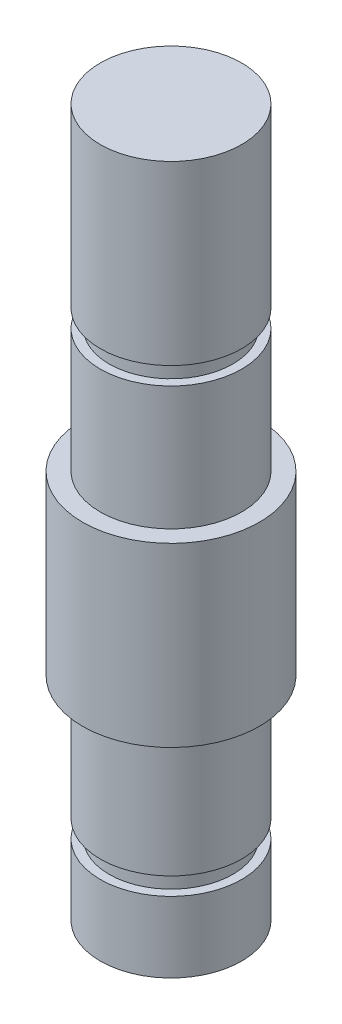
from build123d import *

# Parameters (mm, degrees)
SKETCH1_R           = 5
BOSS_EXTRUDE1_DEPTH = 17
SKETCH2_R           = 5
SKETCH2_R_2         = 4
CUT_EXTRUDE1_DEPTH  = 12
CUT_EXTRUDE2_START  = -4
SKETCH3_R           = 4
SKETCH3_R_2         = 3.5
CUT_EXTRUDE2_DEPTH  = 1
SKETCH4_R           = 4
BOSS_EXTRUDE2_DEPTH = 6


with BuildPart() as part:
    # Sketch1 → Boss-Extrude1 (new, symmetric)
    with BuildSketch(Plane(origin=(0, 0, 0), x_dir=(1, 0, 0), z_dir=(0, 1, 0))):
        with Locations(Location((0, 0, 0), (0, 0, 270))):
            Circle(SKETCH1_R)
    extrude(amount=BOSS_EXTRUDE1_DEPTH, both=True)

    # Sketch2 → Cut-Extrude1 (cut)
    with BuildSketch(Plane(origin=(0, 17, 0), x_dir=(1, 0, 0), z_dir=(0, 1, 0))):
        with Locations(Location((0, 0, 0), (0, 0, 270))):
            Circle(SKETCH2_R)
        with Locations(Location((0, 0, 0), (0, 0, 270))):
            Circle(SKETCH2_R_2, mode=Mode.SUBTRACT)
    cut_extrude1 = extrude(amount=-CUT_EXTRUDE1_DEPTH, mode=Mode.SUBTRACT)

    # Mirror1: Cut-Extrude1 across plane
    add(cut_extrude1.mirror(Plane.ZX), mode=Mode.SUBTRACT)

    # Sketch3 → Cut-Extrude2 (cut)
    with BuildSketch(Plane(origin=(0, 17, 0), x_dir=(1, 0, 0), z_dir=(0, 1, 0)).offset(CUT_EXTRUDE2_START)):
        with Locations(Location((0, 0, 0), (0, 0, 270))):
            Circle(SKETCH3_R)
        with Locations(Location((0, 0, 0), (0, 0, 270))):
            Circle(SKETCH3_R_2, mode=Mode.SUBTRACT)
    cut_extrude2 = extrude(amount=-CUT_EXTRUDE2_DEPTH, mode=Mode.SUBTRACT)

    # Mirror2: Cut-Extrude2 across plane
    add(cut_extrude2.mirror(Plane.ZX), mode=Mode.SUBTRACT)

    # Sketch4 → Boss-Extrude2 (add)
    with BuildSketch(Plane(origin=(0, 17, 0), x_dir=(1, 0, 0), z_dir=(0, 1, 0))):
        with Locations(Location((0, 0, 0), (0, 0, 270))):
            Circle(SKETCH4_R)
    extrude(amount=BOSS_EXTRUDE2_DEPTH)


solid = part.part
